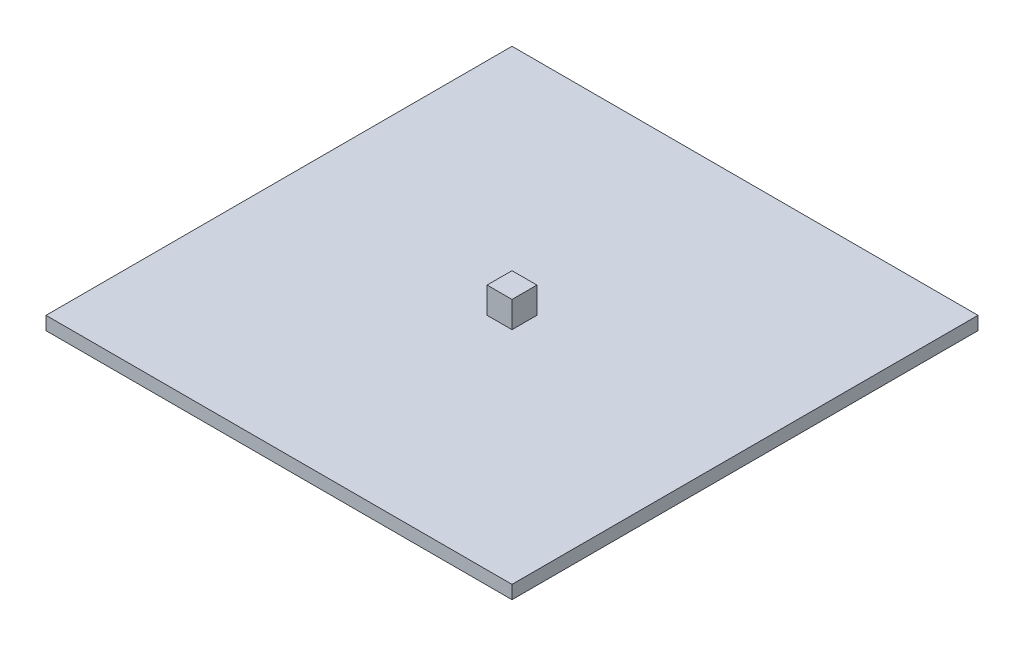
from build123d import *

# Parameters (mm, degrees)
SKETCH1_W           = 88.9
SKETCH1_H           = 88.9
BOSS_EXTRUDE1_DEPTH = 2.54
SKETCH2_W           = 4.75
SKETCH2_H           = 4.75
BOSS_EXTRUDE2_DEPTH = 5


with BuildPart() as part:
    # Sketch1 → Boss-Extrude1 (new body)
    with BuildSketch(Plane(origin=(0, 0, 0), x_dir=(1, 0, 0), z_dir=(0, 1, 0))):
        Rectangle(SKETCH1_W, SKETCH1_H)
    extrude(amount=BOSS_EXTRUDE1_DEPTH)

    # Sketch2 → Boss-Extrude2 (add)
    with BuildSketch(Plane(origin=(0, 2.54, 0), x_dir=(1, 0, 0), z_dir=(0, 1, 0))):
        Rectangle(SKETCH2_W, SKETCH2_H)
    extrude(amount=BOSS_EXTRUDE2_DEPTH)


solid = part.part
